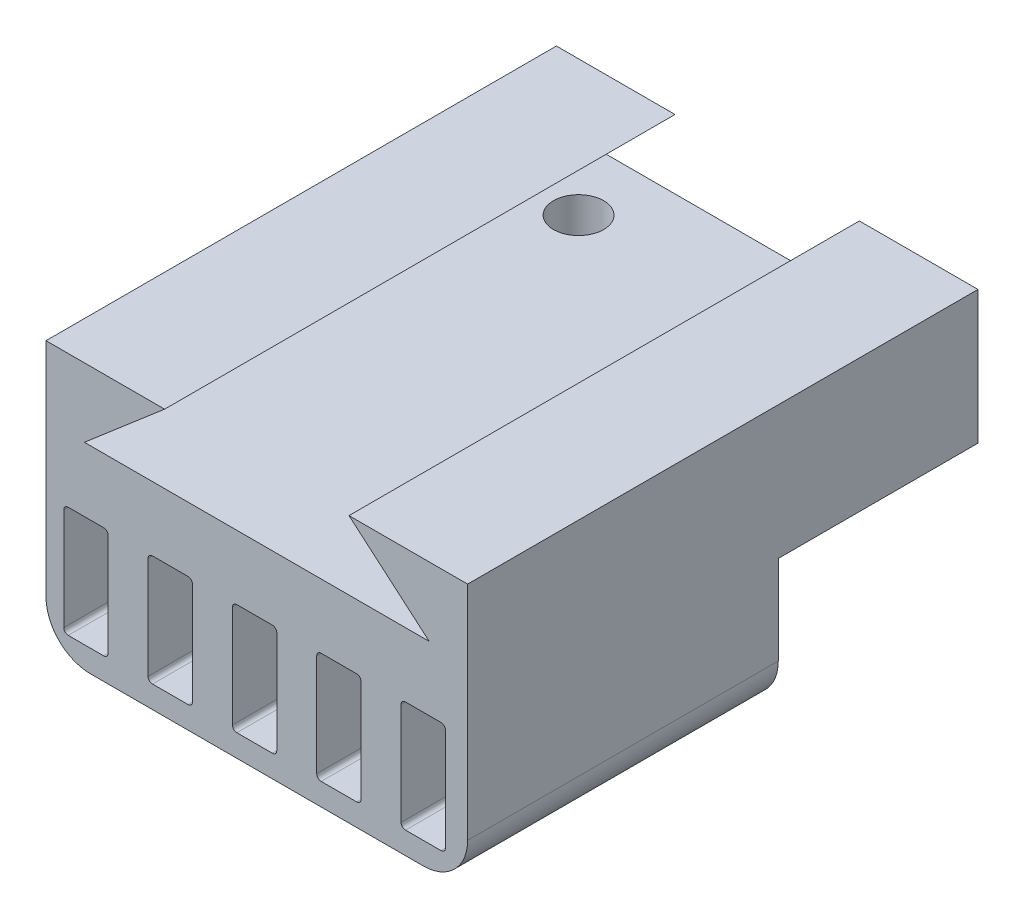
from build123d import *

# Parameters (mm, degrees)
BOSS_EXTRUDE2_DEPTH = 25.4
SKETCH3_W           = 24.13
SKETCH3_H           = 17.78
BOSS_EXTRUDE3_DEPTH = 7.62
CUT_EXTRUDE2_DEPTH  = 16.51
SKETCH5_R           = 0.9525
CUT_EXTRUDE3_DEPTH  = 1.27
FILLET1_R           = 2.54
BOSS_EXTRUDE4_DEPTH = 3.81
SKETCH2_R           = 1.4351
CUT_EXTRUDE1_DEPTH  = 3.683


with BuildPart() as part:
    # Sketch1 → Boss-Extrude2 (new body)
    with BuildSketch(Plane.XY):
        Polygon((9.525, -21.59), (5.275147024, -21.59), (9.868313691, -25.527), (-9.868313691, -25.527), (-5.275147024, -21.59), (-9.525, -21.59), (-12.065, -21.59), (-12.065, -22.494104142), (-12.065, -29.21), (-8.343230433, -29.21), (10.89773699, -29.21), (12.065, -29.21), (12.065, -26.495103927), (12.065, -21.59), align=None)
    extrude(amount=BOSS_EXTRUDE2_DEPTH)

    # Sketch3 → Boss-Extrude3 (add)
    with BuildSketch(Plane(origin=(0, -29.21, 0), x_dir=(-1, 0, 0), z_dir=(0, -1, 0))):
        with Locations((0, -16.51)):
            Rectangle(SKETCH3_W, SKETCH3_H)
    extrude(amount=BOSS_EXTRUDE3_DEPTH)

    # Sketch4 → Cut-Extrude2 (cut)
    with BuildSketch(Plane.XY.offset(25.4)):
        with BuildLine():
            Line((10.541, -35.56), (8.509, -35.56))
            ThreePointArc((8.509, -35.56), (8.329394878, -35.485605122), (8.255, -35.306))
            Line((8.255, -35.306), (8.255, -29.464))
            ThreePointArc((8.255, -29.464), (8.329394878, -29.284394878), (8.509, -29.21))
            Line((8.509, -29.21), (10.541, -29.21))
            ThreePointArc((10.541, -29.21), (10.720605122, -29.284394878), (10.795, -29.464))
            Line((10.795, -29.464), (10.795, -35.306))
            ThreePointArc((10.795, -35.306), (10.720605122, -35.485605122), (10.541, -35.56))
        make_face()
        with BuildLine():
            Line((5.969, -35.306), (5.969, -29.464))
            ThreePointArc((5.969, -29.464), (5.894605122, -29.284394878), (5.715, -29.21))
            Line((5.715, -29.21), (3.683, -29.21))
            ThreePointArc((3.683, -29.21), (3.503394878, -29.284394878), (3.429, -29.464))
            Line((3.429, -29.464), (3.429, -35.306))
            ThreePointArc((3.429, -35.306), (3.503394878, -35.485605122), (3.683, -35.56))
            Line((3.683, -35.56), (5.715, -35.56))
            ThreePointArc((5.715, -35.56), (5.894605122, -35.485605122), (5.969, -35.306))
        make_face()
        with BuildLine():
            Line((1.143, -35.306), (1.143, -29.464))
            ThreePointArc((1.143, -29.464), (1.068605122, -29.284394878), (0.889, -29.21))
            Line((0.889, -29.21), (-1.143, -29.21))
            ThreePointArc((-1.143, -29.21), (-1.322605122, -29.284394878), (-1.397, -29.464))
            Line((-1.397, -29.464), (-1.397, -35.306))
            ThreePointArc((-1.397, -35.306), (-1.322605122, -35.485605122), (-1.143, -35.56))
            Line((-1.143, -35.56), (0.889, -35.56))
            ThreePointArc((0.889, -35.56), (1.068605122, -35.485605122), (1.143, -35.306))
        make_face()
        with BuildLine():
            Line((-3.683, -35.306), (-3.683, -29.464))
            ThreePointArc((-3.683, -29.464), (-3.757394878, -29.284394878), (-3.937, -29.21))
            Line((-3.937, -29.21), (-5.969, -29.21))
            ThreePointArc((-5.969, -29.21), (-6.148605122, -29.284394878), (-6.223, -29.464))
            Line((-6.223, -29.464), (-6.223, -35.306))
            ThreePointArc((-6.223, -35.306), (-6.148605122, -35.485605122), (-5.969, -35.56))
            Line((-5.969, -35.56), (-3.937, -35.56))
            ThreePointArc((-3.937, -35.56), (-3.757394878, -35.485605122), (-3.683, -35.306))
        make_face()
        with BuildLine():
            Line((-8.509, -35.306), (-8.509, -29.464))
            ThreePointArc((-8.509, -29.464), (-8.583394878, -29.284394878), (-8.763, -29.21))
            Line((-8.763, -29.21), (-10.795, -29.21))
            ThreePointArc((-10.795, -29.21), (-10.974605122, -29.284394878), (-11.049, -29.464))
            Line((-11.049, -29.464), (-11.049, -35.306))
            ThreePointArc((-11.049, -35.306), (-10.974605122, -35.485605122), (-10.795, -35.56))
            Line((-10.795, -35.56), (-8.763, -35.56))
            ThreePointArc((-8.763, -35.56), (-8.583394878, -35.485605122), (-8.509, -35.306))
        make_face()
    extrude(amount=-CUT_EXTRUDE2_DEPTH, mode=Mode.SUBTRACT)

    # Sketch5 → Cut-Extrude3 (cut)
    with BuildSketch(Plane.XY.offset(8.89)):
        with Locations((9.525, -32.385)):
            Circle(SKETCH5_R)
        with Locations((4.699, -32.385)):
            Circle(SKETCH5_R)
        with Locations((-0.127, -32.385)):
            Circle(SKETCH5_R)
        with Locations((-4.953, -32.385)):
            Circle(SKETCH5_R)
        with Locations((-9.779, -32.385)):
            Circle(SKETCH5_R)
    extrude(amount=-CUT_EXTRUDE3_DEPTH, mode=Mode.SUBTRACT)

    # Fillet1
    fillet1_edges = [part.edges().sort_by_distance(p)[0] for p in [
        (12.065, -36.83, 16.51),
        (-12.065, -36.83, 16.51),
    ]]
    fillet(fillet1_edges, radius=FILLET1_R)

    # Sketch6 → Boss-Extrude4 (add)
    with BuildSketch(Plane(origin=(0, 0, 0), x_dir=(-1, 0, 0), z_dir=(0, 0, -1))):
        Polygon((-12.065, -29.21), (12.065, -29.21), (12.065, -21.59), (5.275147024, -21.59), (9.868313691, -25.527), (-9.868313691, -25.527), (-5.275147024, -21.59), (-12.065, -21.59), align=None)
    extrude(amount=BOSS_EXTRUDE4_DEPTH)

    # Sketch2 → Cut-Extrude1 (cut)
    with BuildSketch(Plane(origin=(0, -29.21, 0), x_dir=(-1, 0, 0), z_dir=(0, -1, 0))):
        with Locations(Location((-6.985, 0, 0), (0, 0, 90))):
            Circle(SKETCH2_R)
        with Locations(Location((6.985, 0, 0), (0, 0, 90))):
            Circle(SKETCH2_R)
    extrude(amount=-CUT_EXTRUDE1_DEPTH, mode=Mode.SUBTRACT)


solid = part.part
